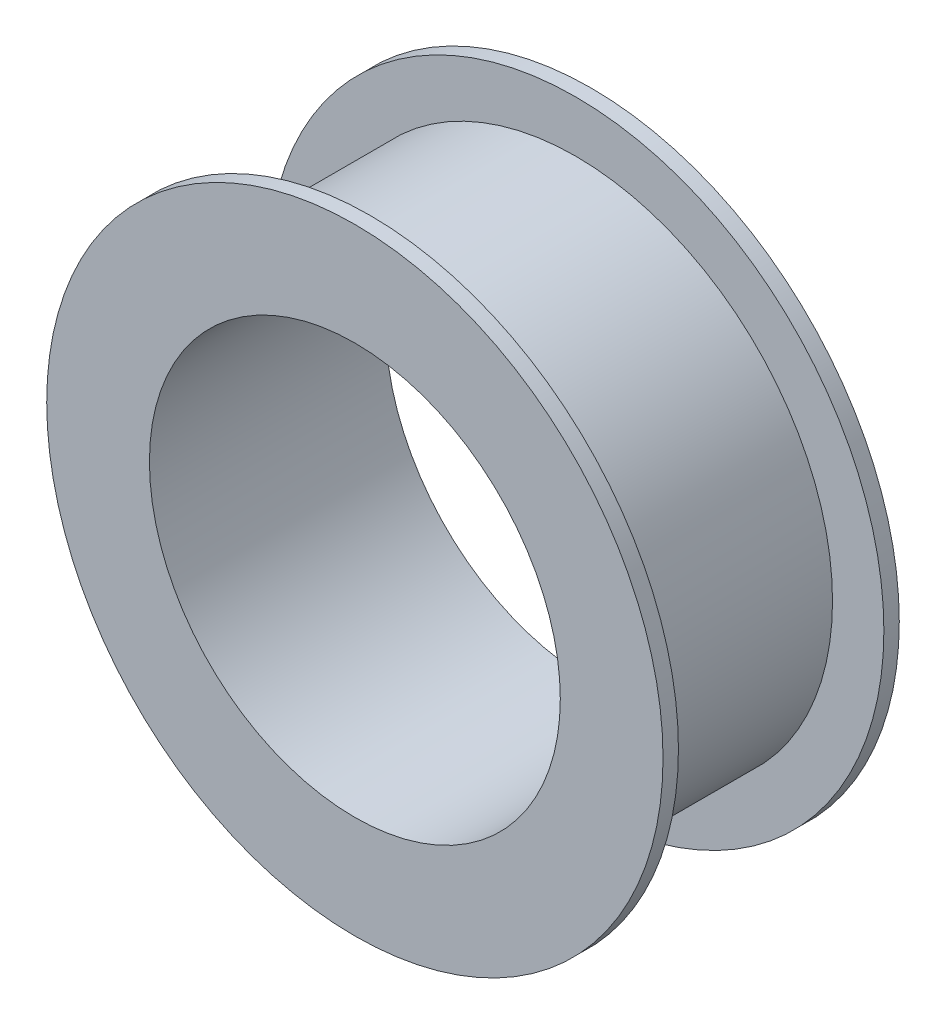
from build123d import *

# Parameters (mm, degrees)
CROQUIS1_R              = 50
CROQUIS1_R_2            = 40
SALIENTE_EXTRUIR2_DEPTH = 40
CROQUIS2_R              = 60
CROQUIS2_R_2            = 40
SALIENTE_EXTRUIR3_DEPTH = 3
SALIENTE_EXTRUIR4_START = 3
CROQUIS3_R              = 60
CROQUIS3_R_2            = 40
SALIENTE_EXTRUIR4_DEPTH = 3


with BuildPart() as part:
    # Croquis1 → Saliente-Extruir2 (new body)
    with BuildSketch(Plane.XY):
        Circle(CROQUIS1_R)
        Circle(CROQUIS1_R_2, mode=Mode.SUBTRACT)
    extrude(amount=SALIENTE_EXTRUIR2_DEPTH)

    # Croquis2 → Saliente-Extruir3 (add)
    with BuildSketch(Plane.XY.offset(40)):
        Circle(CROQUIS2_R)
        Circle(CROQUIS2_R_2, mode=Mode.SUBTRACT)
    extrude(amount=SALIENTE_EXTRUIR3_DEPTH)

    # Croquis3 → Saliente-Extruir4 (add)
    with BuildSketch(Plane(origin=(0, 0, 0), x_dir=(-1, 0, 0), z_dir=(0, 0, -1)).offset(SALIENTE_EXTRUIR4_START)):
        with Locations(Location((0, 0, 0), (0, 0, 180))):
            Circle(CROQUIS3_R)
        Circle(CROQUIS3_R_2, mode=Mode.SUBTRACT)
    extrude(amount=-SALIENTE_EXTRUIR4_DEPTH)


solid = part.part
